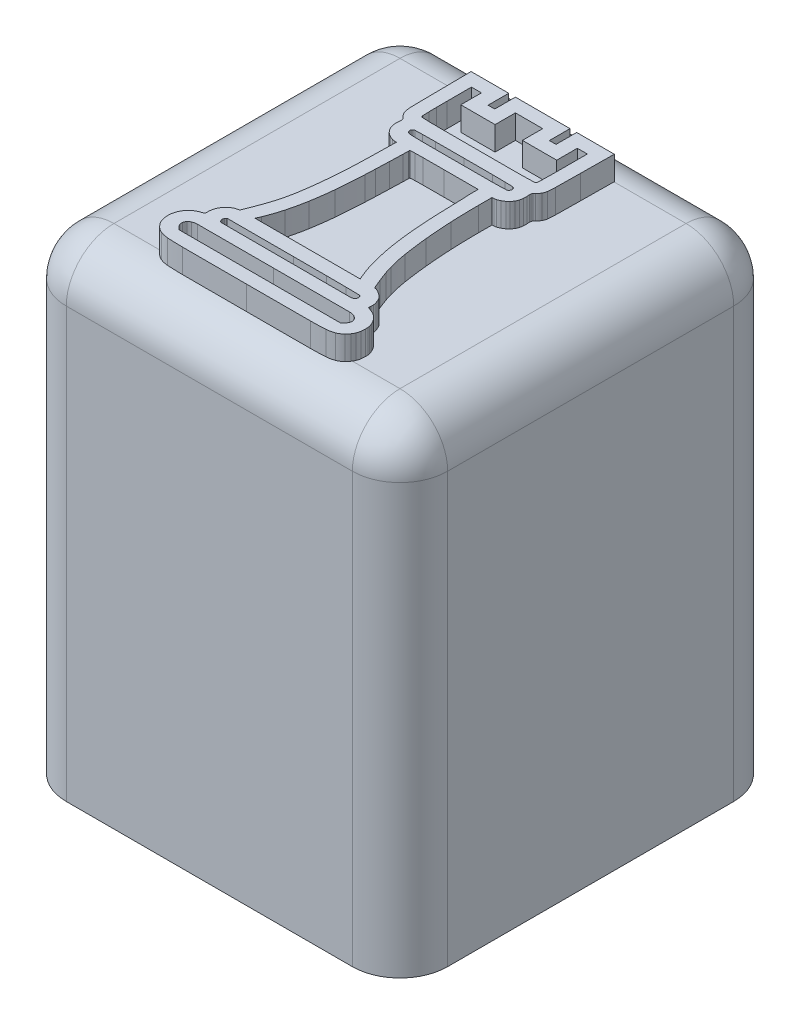
from build123d import *

# Parameters (mm, degrees)
SKETCH1_W           = 40
SKETCH1_H           = 40
BOSS_EXTRUDE1_DEPTH = 50
FILLET2_R           = 5
BOSS_EXTRUDE5_DEPTH = 2.5


with BuildPart() as part:
    # Sketch1 → Boss-Extrude1 (new body)
    with BuildSketch(Plane(origin=(0, 0, 0), x_dir=(1, 0, 0), z_dir=(0, 1, 0))):
        Rectangle(SKETCH1_W, SKETCH1_H)
    extrude(amount=BOSS_EXTRUDE1_DEPTH)

    # Fillet2
    fillet2_edges = [part.edges().sort_by_distance(p)[0] for p in [
        (0, 50, 20),
        (-20, 50, 0),
        (0, 50, -20),
        (20, 50, 0),
        (20, 25, -20),
        (-20, 25, -20),
        (-20, 25, 20),
        (20, 25, 20),
    ]]
    fillet(fillet2_edges, radius=FILLET2_R)

    # Sketch7 → Boss-Extrude5 (add)
    with BuildSketch(Plane(origin=(0, 50, 0), x_dir=(1, 0, 0), z_dir=(0, 1, 0))):
        with BuildLine():
            Line((-5.274613315, 4.694031011), (-5.071502507, 4.693348647))
            Line((-5.071502507, 4.693348647), (-5.115931857, 2.440686147))
            ThreePointArc((-5.115931857, 2.440686147), (-5.135493361, 1.586777154), (-5.160492105, 0.733010041))
            ThreePointArc((-5.160492105, 0.733010041), (-5.186559634, 0.065160432), (-5.221382725, -0.602289917))
            ThreePointArc((-5.221382725, -0.602289917), (-5.262100246, -1.217994079), (-5.31186865, -1.833032808))
            ThreePointArc((-5.31186865, -1.833032808), (-5.375915726, -2.516439369), (-5.447270012, -3.199121668))
            ThreePointArc((-5.447270012, -3.199121668), (-5.544021498, -3.997931443), (-5.658389751, -4.794409823))
            ThreePointArc((-5.658389751, -4.794409823), (-5.774097432, -5.459438073), (-5.914466137, -6.119701254))
            ThreePointArc((-5.914466137, -6.119701254), (-6.070211142, -6.734003471), (-6.25066229, -7.341507465))
            ThreePointArc((-6.25066229, -7.341507465), (-6.4669483, -7.982117191), (-6.704447145, -8.615169129))
            Line((-6.704447145, -8.615169129), (-7.118383624, -9.665011975))
            Line((-7.118383624, -9.665011975), (-7.44877615, -9.762565253))
            ThreePointArc((-7.44877615, -9.762565253), (-7.628823527, -9.830715509), (-7.796714017, -9.924919005))
            ThreePointArc((-7.796714017, -9.924919005), (-7.96786677, -10.052607106), (-8.123996332, -10.19828166))
            ThreePointArc((-8.123996332, -10.19828166), (-8.265734193, -10.362837202), (-8.388878289, -10.541732923))
            ThreePointArc((-8.388878289, -10.541732923), (-8.482889519, -10.72129569), (-8.552271199, -10.911734869))
            ThreePointArc((-8.552271199, -10.911734869), (-8.574954627, -10.995786253), (-8.594375103, -11.080650958))
            ThreePointArc((-8.594375103, -11.080650958), (-8.611882419, -11.171820917), (-8.626475998, -11.263502402))
            ThreePointArc((-8.626475998, -11.263502402), (-8.637187765, -11.348276402), (-8.645142851, -11.433353365))
            ThreePointArc((-8.645142851, -11.433353365), (-8.647401754, -11.495608211), (-8.644586566, -11.557840384))
            ThreePointArc((-8.644586566, -11.557840384), (-8.640027054, -11.635308954), (-8.639679254, -11.712910806))
            ThreePointArc((-8.639679254, -11.712910806), (-8.647075054, -11.752525478), (-8.666690598, -11.787728469))
            ThreePointArc((-8.666690598, -11.787728469), (-8.697849705, -11.817602005), (-8.73589714, -11.837990992))
            ThreePointArc((-8.73589714, -11.837990992), (-8.824213052, -11.869091004), (-8.913544061, -11.897142417))
            ThreePointArc((-8.913544061, -11.897142417), (-9.225813535, -12.016966022), (-9.515244254, -12.184595912))
            ThreePointArc((-9.515244254, -12.184595912), (-9.771838642, -12.39450575), (-9.99101328, -12.643233108))
            ThreePointArc((-9.99101328, -12.643233108), (-10.167275029, -12.92459187), (-10.295688922, -13.230763111))
            ThreePointArc((-10.295688922, -13.230763111), (-10.374607959, -13.557101502), (-10.401466688, -13.891770844))
            ThreePointArc((-10.401466688, -13.891770844), (-10.393160937, -14.124937934), (-10.367596633, -14.35684814))
            ThreePointArc((-10.367596633, -14.35684814), (-10.326822143, -14.551570422), (-10.263206436, -14.740070735))
            ThreePointArc((-10.263206436, -14.740070735), (-10.178410285, -14.917660686), (-10.072811681, -15.083725471))
            ThreePointArc((-10.072811681, -15.083725471), (-9.932582512, -15.262008926), (-9.778675217, -15.428627518))
            ThreePointArc((-9.778675217, -15.428627518), (-9.495185465, -15.657409016), (-9.169774886, -15.821163004))
            ThreePointArc((-9.169774886, -15.821163004), (-8.774531746, -15.937344072), (-8.366484798, -15.994026247))
            ThreePointArc((-8.366484798, -15.994026247), (-7.57729415, -16.032346599), (-6.787292878, -16.046069457))
            ThreePointArc((-6.787292878, -16.046069457), (-3.425822319, -16.050594706), (-0.064349053, -16.052101353))
            ThreePointArc((-0.064349053, -16.052101353), (3.297124214, -16.050594706), (6.658594772, -16.046069457))
            ThreePointArc((6.658594772, -16.046069457), (7.448596045, -16.032346599), (8.237786692, -15.994026247))
            ThreePointArc((8.237786692, -15.994026247), (8.64583364, -15.937344072), (9.04107678, -15.821163004))
            ThreePointArc((9.04107678, -15.821163004), (9.366487359, -15.657409016), (9.649977112, -15.428627518))
            ThreePointArc((9.649977112, -15.428627518), (9.804085436, -15.261775175), (9.94447938, -15.083229326))
            ThreePointArc((9.94447938, -15.083229326), (10.050071007, -14.917026777), (10.134768173, -14.739264945))
            ThreePointArc((10.134768173, -14.739264945), (10.198411696, -14.550054304), (10.23914384, -14.354626421))
            ThreePointArc((10.23914384, -14.354626421), (10.264862639, -14.120672036), (10.273450947, -13.885464996))
            ThreePointArc((10.273450947, -13.885464996), (10.270947173, -13.756388341), (10.263439766, -13.627505872))
            ThreePointArc((10.263439766, -13.627505872), (10.251594995, -13.526724896), (10.231851151, -13.427189553))
            ThreePointArc((10.231851151, -13.427189553), (10.204123074, -13.328552452), (10.168830246, -13.232362327))
            ThreePointArc((10.168830246, -13.232362327), (10.116177863, -13.110788077), (10.059127189, -12.991214701))
            ThreePointArc((10.059127189, -12.991214701), (9.938919874, -12.778042333), (9.798016084, -12.577946408))
            ThreePointArc((9.798016084, -12.577946408), (9.646975622, -12.407709544), (9.475993335, -12.257513445))
            ThreePointArc((9.475993335, -12.257513445), (9.279164164, -12.122778377), (9.067986143, -12.011877049))
            ThreePointArc((9.067986143, -12.011877049), (8.81178561, -11.907252136), (8.548462659, -11.822128057))
            ThreePointArc((8.548462659, -11.822128057), (8.529373641, -11.812444577), (8.515377158, -11.796250169))
            ThreePointArc((8.515377158, -11.796250169), (8.503559264, -11.770551628), (8.496390112, -11.743189594))
            ThreePointArc((8.496390112, -11.743189594), (8.491978174, -11.703792653), (8.492103208, -11.664149639))
            ThreePointArc((8.492103208, -11.664149639), (8.496598204, -11.611759341), (8.50371598, -11.559660535))
            ThreePointArc((8.50371598, -11.559660535), (8.515327315, -11.418385332), (8.504602027, -11.277040101))
            ThreePointArc((8.504602027, -11.277040101), (8.469877186, -11.099484949), (8.421586909, -10.925129864))
            ThreePointArc((8.421586909, -10.925129864), (8.357807239, -10.748613268), (8.280807377, -10.577449672))
            ThreePointArc((8.280807377, -10.577449672), (8.200014785, -10.435861025), (8.103432942, -10.304534197))
            ThreePointArc((8.103432942, -10.304534197), (8.00739313, -10.201008589), (7.900383602, -10.108866535))
            ThreePointArc((7.900383602, -10.108866535), (7.753952226, -10.002582002), (7.601992923, -9.904363268))
            ThreePointArc((7.601992923, -9.904363268), (7.452579423, -9.818478024), (7.299046907, -9.740193695))
            ThreePointArc((7.299046907, -9.740193695), (7.203648634, -9.707001547), (7.103269441, -9.695751353))
            ThreePointArc((7.103269441, -9.695751353), (7.035141561, -9.675167106), (6.989809991, -9.620302107))
            ThreePointArc((6.989809991, -9.620302107), (6.794147044, -9.149794258), (6.601327621, -8.678113968))
            ThreePointArc((6.601327621, -8.678113968), (6.415795526, -8.206873439), (6.239699712, -7.732026033))
            ThreePointArc((6.239699712, -7.732026033), (6.105366415, -7.336600456), (5.985085356, -6.936676353))
            ThreePointArc((5.985085356, -6.936676353), (5.746997048, -5.983856003), (5.565746818, -5.018609393))
            ThreePointArc((5.565746818, -5.018609393), (5.387145974, -3.768080321), (5.24394682, -2.513004536))
            ThreePointArc((5.24394682, -2.513004536), (5.121296012, -1.096537503), (5.035800875, 0.322656867))
            ThreePointArc((5.035800875, 0.322656867), (4.983441307, 1.800362149), (4.965518853, 3.278886147))
            Line((4.965518853, 3.278886147), (4.964850947, 4.693348647))
            Line((4.964850947, 4.693348647), (5.156938447, 4.694031011))
            ThreePointArc((5.156938447, 4.694031011), (5.284693719, 4.705324601), (5.408721643, 4.737974694))
            ThreePointArc((5.408721643, 4.737974694), (5.572045946, 4.802449755), (5.730617754, 4.877860914))
            ThreePointArc((5.730617754, 4.877860914), (5.889526273, 4.967131234), (6.042008635, 5.066982304))
            ThreePointArc((6.042008635, 5.066982304), (6.160206761, 5.161178066), (6.266465254, 5.268661885))
            ThreePointArc((6.266465254, 5.268661885), (6.381636634, 5.41317896), (6.482530094, 5.568001895))
            ThreePointArc((6.482530094, 5.568001895), (6.56197389, 5.723182125), (6.623338194, 5.886358846))
            ThreePointArc((6.623338194, 5.886358846), (6.667211764, 6.059617931), (6.691814384, 6.236644233))
            ThreePointArc((6.691814384, 6.236644233), (6.700170548, 6.433951482), (6.692413208, 6.631283182))
            ThreePointArc((6.692413208, 6.631283182), (6.681807637, 6.78211385), (6.674190601, 6.933124939))
            ThreePointArc((6.674190601, 6.933124939), (6.676901816, 7.00258216), (6.69057783, 7.07073363))
            ThreePointArc((6.69057783, 7.07073363), (6.71373595, 7.128023504), (6.748490954, 7.179116732))
            ThreePointArc((6.748490954, 7.179116732), (6.818549413, 7.257725686), (6.892302325, 7.332879283))
            ThreePointArc((6.892302325, 7.332879283), (7.054166821, 7.515677205), (7.186783429, 7.720684597))
            ThreePointArc((7.186783429, 7.720684597), (7.276036497, 7.928936012), (7.324793617, 8.150199442))
            ThreePointArc((7.324793617, 8.150199442), (7.361267317, 8.529446009), (7.377212829, 8.910108628))
            ThreePointArc((7.377212829, 8.910108628), (7.395008806, 10.21564498), (7.409600947, 11.521221072))
            Line((7.409600947, 11.521221072), (7.444525947, 15.031218497))
            Line((7.444525947, 15.031218497), (5.471263447, 15.031183572))
            Line((5.471263447, 15.031183572), (3.498000947, 15.031148647))
            Line((3.498000947, 15.031148647), (3.498000947, 13.948473647))
            Line((3.498000947, 13.948473647), (3.498000947, 12.865798647))
            Line((3.498000947, 12.865798647), (3.148750947, 12.865798647))
            Line((3.148750947, 12.865798647), (2.799500947, 12.865798647))
            Line((2.799500947, 12.865798647), (2.799500947, 13.948473647))
            Line((2.799500947, 13.948473647), (2.799500947, 15.031148647))
            Line((2.799500947, 15.031148647), (-0.064349053, 15.031148647))
            Line((-0.064349053, 15.031148647), (-2.928199053, 15.031148647))
            Line((-2.928199053, 15.031148647), (-2.928199053, 13.948473647))
            Line((-2.928199053, 13.948473647), (-2.928199053, 12.865798647))
            Line((-2.928199053, 12.865798647), (-3.277449053, 12.865798647))
            Line((-3.277449053, 12.865798647), (-3.626699053, 12.865798647))
            Line((-3.626699053, 12.865798647), (-3.626699053, 13.948473647))
            Line((-3.626699053, 13.948473647), (-3.626699053, 15.031148647))
            Line((-3.626699053, 15.031148647), (-5.599961553, 15.031183572))
            Line((-5.599961553, 15.031183572), (-7.573224053, 15.031218497))
            Line((-7.573224053, 15.031218497), (-7.538299053, 11.521221072))
            ThreePointArc((-7.538299053, 11.521221072), (-7.523706911, 10.21564498), (-7.505910935, 8.910108628))
            ThreePointArc((-7.505910935, 8.910108628), (-7.489965422, 8.529446009), (-7.453491723, 8.150199442))
            ThreePointArc((-7.453491723, 8.150199442), (-7.404734603, 7.928936012), (-7.315481534, 7.720684597))
            ThreePointArc((-7.315481534, 7.720684597), (-7.182864927, 7.515677205), (-7.02100043, 7.332879283))
            ThreePointArc((-7.02100043, 7.332879283), (-6.947247518, 7.257725686), (-6.877189059, 7.179116732))
            ThreePointArc((-6.877189059, 7.179116732), (-6.842434056, 7.128023504), (-6.819275935, 7.07073363))
            ThreePointArc((-6.819275935, 7.07073363), (-6.805599922, 7.00258216), (-6.802888706, 6.933124939))
            ThreePointArc((-6.802888706, 6.933124939), (-6.810505743, 6.78211385), (-6.821111314, 6.631283182))
            ThreePointArc((-6.821111314, 6.631283182), (-6.828868653, 6.433951482), (-6.82051249, 6.236644233))
            ThreePointArc((-6.82051249, 6.236644233), (-6.79590987, 6.059617931), (-6.7520363, 5.886358846))
            ThreePointArc((-6.7520363, 5.886358846), (-6.690671995, 5.723182125), (-6.611228199, 5.568001895))
            ThreePointArc((-6.611228199, 5.568001895), (-6.510334739, 5.41317896), (-6.39516336, 5.268661885))
            ThreePointArc((-6.39516336, 5.268661885), (-6.287832472, 5.160118491), (-6.168422436, 5.065024688))
            ThreePointArc((-6.168422436, 5.065024688), (-6.015546931, 4.965211527), (-5.856090047, 4.876289708))
            ThreePointArc((-5.856090047, 4.876289708), (-5.696623457, 4.801435919), (-5.53231525, 4.737910362))
            ThreePointArc((-5.53231525, 4.737910362), (-5.405281678, 4.705297188), (-5.274613315, 4.694031011))
        make_face()
        with BuildLine():
            Line((-5.093549053, 12.551473647), (-5.093549053, 11.468798647))
            Line((-5.093549053, 11.468798647), (-3.294911553, 11.468741579))
            Line((-3.294911553, 11.468741579), (-1.496274053, 11.468684512))
            Line((-1.496274053, 11.468684512), (-1.496274053, 12.533954079))
            Line((-1.496274053, 12.533954079), (-1.496274053, 13.599223647))
            Line((-1.496274053, 13.599223647), (-0.064349053, 13.599223647))
            Line((-0.064349053, 13.599223647), (1.367575947, 13.599223647))
            Line((1.367575947, 13.599223647), (1.367575947, 12.5339538))
            Line((1.367575947, 12.5339538), (1.367575947, 11.468683883))
            Line((1.367575947, 11.468683883), (3.166213447, 11.4687413))
            Line((3.166213447, 11.4687413), (4.964850947, 11.468798647))
            Line((4.964850947, 11.468798647), (4.964850947, 12.551473647))
            Line((4.964850947, 12.551473647), (4.964850947, 13.634148647))
            Line((4.964850947, 13.634148647), (5.488725947, 13.634148647))
            Line((5.488725947, 13.634148647), (6.012600947, 13.634148647))
            Line((6.012600947, 13.634148647), (6.012600947, 11.080031638))
            ThreePointArc((6.012600947, 11.080031638), (6.01148728, 10.530998263), (6.008146752, 9.981973922))
            ThreePointArc((6.008146752, 9.981973922), (6.002867641, 9.569730256), (5.993720352, 9.157554279))
            ThreePointArc((5.993720352, 9.157554279), (5.984313066, 8.835473662), (5.973412722, 8.513440117))
            ThreePointArc((5.973412722, 8.513440117), (5.963861843, 8.450230522), (5.940293345, 8.390806638))
            ThreePointArc((5.940293345, 8.390806638), (5.88171471, 8.327629623), (5.79968271, 8.301294422))
            ThreePointArc((5.79968271, 8.301294422), (5.442003442, 8.284680412), (5.084104735, 8.273771706))
            ThreePointArc((5.084104735, 8.273771706), (4.432606634, 8.262561831), (3.781026372, 8.25824915))
            ThreePointArc((3.781026372, 8.25824915), (1.858339083, 8.256335566), (-0.064349053, 8.255698647))
            ThreePointArc((-0.064349053, 8.255698647), (-1.987037188, 8.256335566), (-3.909724477, 8.25824915))
            ThreePointArc((-3.909724477, 8.25824915), (-4.561304739, 8.262561831), (-5.21280284, 8.273771706))
            ThreePointArc((-5.21280284, 8.273771706), (-5.570701547, 8.284680412), (-5.928380816, 8.301294422))
            ThreePointArc((-5.928380816, 8.301294422), (-6.010412815, 8.327629623), (-6.06899145, 8.390806638))
            ThreePointArc((-6.06899145, 8.390806638), (-6.092559949, 8.450230522), (-6.102110828, 8.513440117))
            ThreePointArc((-6.102110828, 8.513440117), (-6.113011171, 8.835473662), (-6.122418458, 9.157554279))
            ThreePointArc((-6.122418458, 9.157554279), (-6.131565747, 9.569730256), (-6.136844858, 9.981973922))
            ThreePointArc((-6.136844858, 9.981973922), (-6.140185386, 10.530998263), (-6.141299053, 11.080031638))
            Line((-6.141299053, 11.080031638), (-6.141299053, 13.634148647))
            Line((-6.141299053, 13.634148647), (-5.617424053, 13.634148647))
            Line((-5.617424053, 13.634148647), (-5.093549053, 13.634148647))
            Line((-5.093549053, 13.634148647), (-5.093549053, 12.551473647))
        make_face(mode=Mode.SUBTRACT)
        with BuildLine():
            Line((5.311218447, -9.304851824), (5.448836358, -9.625901353))
            Line((5.448836358, -9.625901353), (-0.0628697, -9.625901353))
            Line((-0.0628697, -9.625901353), (-5.574575828, -9.625901353))
            Line((-5.574575828, -9.625901353), (-5.370805426, -9.131752977))
            ThreePointArc((-5.370805426, -9.131752977), (-5.035681898, -8.239677913), (-4.757872235, -7.328125672))
            ThreePointArc((-4.757872235, -7.328125672), (-4.505387227, -6.300156381), (-4.300875048, -5.261578357))
            ThreePointArc((-4.300875048, -5.261578357), (-4.115158549, -4.045942489), (-3.977270615, -2.823957178))
            ThreePointArc((-3.977270615, -2.823957178), (-3.857496972, -1.354069539), (-3.771384247, 0.118173647))
            ThreePointArc((-3.771384247, 0.118173647), (-3.748154646, 0.64081029), (-3.727606458, 1.163559224))
            ThreePointArc((-3.727606458, 1.163559224), (-3.702534665, 1.866669878), (-3.678980241, 2.569832999))
            ThreePointArc((-3.678980241, 2.569832999), (-3.657485177, 3.250874182), (-3.637156087, 3.931951166))
            ThreePointArc((-3.637156087, 3.931951166), (-3.6299927, 4.251497885), (-3.627029234, 4.571111147))
            ThreePointArc((-3.627029234, 4.571111147), (-3.60654598, 4.623378762), (-3.556136932, 4.648084939))
            ThreePointArc((-3.556136932, 4.648084939), (-3.328406081, 4.664569002), (-3.100331036, 4.675285297))
            ThreePointArc((-3.100331036, 4.675285297), (-2.685022898, 4.686231704), (-2.269593252, 4.690577069))
            ThreePointArc((-2.269593252, 4.690577069), (-1.166972023, 4.692655304), (-0.064349053, 4.693348647))
            Line((-0.064349053, 4.693348647), (3.498000947, 4.693348647))
            Line((3.498000947, 4.693348647), (3.503191501, 4.047236147))
            ThreePointArc((3.503191501, 4.047236147), (3.50461395, 3.918414203), (3.506811617, 3.789603153))
            ThreePointArc((3.506811617, 3.789603153), (3.509664845, 3.669730443), (3.513412232, 3.549882353))
            ThreePointArc((3.513412232, 3.549882353), (3.517240766, 3.449311397), (3.521684917, 3.348765763))
            ThreePointArc((3.521684917, 3.348765763), (3.524976841, 3.304969456), (3.530696615, 3.261423647))
            ThreePointArc((3.530696615, 3.261423647), (3.537323619, 3.210006224), (3.540833386, 3.158282438))
            ThreePointArc((3.540833386, 3.158282438), (3.550216474, 2.904046976), (3.559270573, 2.649799584))
            ThreePointArc((3.559270573, 2.649799584), (3.569228587, 2.35229075), (3.578300577, 2.054753581))
            ThreePointArc((3.578300577, 2.054753581), (3.58780848, 1.715122817), (3.596634386, 1.375473647))
            ThreePointArc((3.596634386, 1.375473647), (3.66056057, -0.319669046), (3.767576754, -2.012637694))
            ThreePointArc((3.767576754, -2.012637694), (3.906273927, -3.442778117), (4.104421674, -4.86590004))
            ThreePointArc((4.104421674, -4.86590004), (4.329425819, -6.076901902), (4.613540163, -7.275414068))
            ThreePointArc((4.613540163, -7.275414068), (4.924900663, -8.30301732), (5.311218447, -9.304851824))
        make_face(mode=Mode.SUBTRACT)
        with BuildLine():
            Line((-7.144893864, -11.240470273), (-7.041427504, -11.092751353))
            Line((-7.041427504, -11.092751353), (-0.074358278, -11.092751353))
            ThreePointArc((-0.074358278, -11.092751353), (1.664349157, -11.093678868), (3.403054611, -11.096463322))
            ThreePointArc((3.403054611, -11.096463322), (4.413642511, -11.10108489), (5.424195863, -11.110634001))
            ThreePointArc((5.424195863, -11.110634001), (6.145080941, -11.119713418), (6.86595246, -11.129812157))
            ThreePointArc((6.86595246, -11.129812157), (6.925802853, -11.142405321), (6.976530947, -11.176571353))
            ThreePointArc((6.976530947, -11.176571353), (7.019623184, -11.233348183), (7.045853999, -11.299624073))
            ThreePointArc((7.045853999, -11.299624073), (7.059002671, -11.38271371), (7.058116027, -11.466832609))
            ThreePointArc((7.058116027, -11.466832609), (7.043424655, -11.547369715), (7.01514249, -11.624195369))
            ThreePointArc((7.01514249, -11.624195369), (6.977844129, -11.678829397), (6.925242956, -11.718943751))
            ThreePointArc((6.925242956, -11.718943751), (6.764446461, -11.781022842), (6.593374919, -11.802090676))
            ThreePointArc((6.593374919, -11.802090676), (3.229688423, -11.800134171), (-0.133997256, -11.797081104))
            ThreePointArc((-0.133997256, -11.797081104), (-3.530896846, -11.793117317), (-6.927795594, -11.788487738))
            ThreePointArc((-6.927795594, -11.788487738), (-7.023595134, -11.766141922), (-7.099803175, -11.703938853))
            ThreePointArc((-7.099803175, -11.703938853), (-7.141767494, -11.643557786), (-7.177342053, -11.579204635))
            ThreePointArc((-7.177342053, -11.579204635), (-7.199063923, -11.522291564), (-7.21034073, -11.46242696))
            ThreePointArc((-7.21034073, -11.46242696), (-7.210198107, -11.405911956), (-7.198884981, -11.350540671))
            ThreePointArc((-7.198884981, -11.350540671), (-7.176162741, -11.293409348), (-7.144893864, -11.240470273))
        make_face(mode=Mode.SUBTRACT)
        with BuildLine():
            Line((8.638960947, -14.417611353), (8.401470947, -14.655101353))
            Line((8.401470947, -14.655101353), (-0.064349053, -14.655101353))
            Line((-0.064349053, -14.655101353), (-8.530169053, -14.655101353))
            Line((-8.530169053, -14.655101353), (-8.767659053, -14.417611353))
            ThreePointArc((-8.767659053, -14.417611353), (-8.88247838, -14.276208898), (-8.965823643, -14.114246866))
            ThreePointArc((-8.965823643, -14.114246866), (-9.003952656, -13.953827062), (-8.99674973, -13.789095605))
            ThreePointArc((-8.99674973, -13.789095605), (-8.944838395, -13.633275087), (-8.852059506, -13.497750557))
            ThreePointArc((-8.852059506, -13.497750557), (-8.716878514, -13.377752757), (-8.559624658, -13.288620285))
            ThreePointArc((-8.559624658, -13.288620285), (-8.315729116, -13.210996607), (-8.061145791, -13.184580666))
            ThreePointArc((-8.061145791, -13.184580666), (-4.069109832, -13.181344122), (-0.077072859, -13.179800202))
            ThreePointArc((-0.077072859, -13.179800202), (3.910991397, -13.179975264), (7.899055194, -13.181897099))
            ThreePointArc((7.899055194, -13.181897099), (8.16243831, -13.20818271), (8.415540553, -13.285647888))
            ThreePointArc((8.415540553, -13.285647888), (8.577072406, -13.373780918), (8.716997926, -13.4932833))
            ThreePointArc((8.716997926, -13.4932833), (8.81306321, -13.628152583), (8.867693224, -13.784465807))
            ThreePointArc((8.867693224, -13.784465807), (8.876548716, -13.949805925), (8.838927667, -14.111052416))
            ThreePointArc((8.838927667, -14.111052416), (8.754897481, -14.274738053), (8.638960947, -14.417611353))
        make_face(mode=Mode.SUBTRACT)
        with BuildLine():
            ThreePointArc((5.282717691, 6.570156469), (5.247939067, 6.627795068), (5.204336632, 6.679084331))
            ThreePointArc((5.204336632, 6.679084331), (5.133298271, 6.727566322), (5.049476108, 6.746822416))
            ThreePointArc((5.049476108, 6.746822416), (4.65335071, 6.760559933), (4.25711545, 6.770643082))
            ThreePointArc((4.25711545, 6.770643082), (3.599112829, 6.781266077), (2.941039539, 6.785720624))
            ThreePointArc((2.941039539, 6.785720624), (1.438346056, 6.788066036), (-0.064349053, 6.788848647))
            ThreePointArc((-0.064349053, 6.788848647), (-1.567044162, 6.788066036), (-3.069737645, 6.785720624))
            ThreePointArc((-3.069737645, 6.785720624), (-3.727810934, 6.781266077), (-4.385813556, 6.770643082))
            ThreePointArc((-4.385813556, 6.770643082), (-4.782048815, 6.760559933), (-5.178174214, 6.746822416))
            ThreePointArc((-5.178174214, 6.746822416), (-5.261996377, 6.727566322), (-5.333034737, 6.679084331))
            ThreePointArc((-5.333034737, 6.679084331), (-5.377977158, 6.625421614), (-5.412804275, 6.564704397))
            ThreePointArc((-5.412804275, 6.564704397), (-5.432473619, 6.504328012), (-5.437526984, 6.441029873))
            ThreePointArc((-5.437526984, 6.441029873), (-5.427696729, 6.377590471), (-5.403571642, 6.318099531))
            ThreePointArc((-5.403571642, 6.318099531), (-5.36401268, 6.258318315), (-5.315061494, 6.205949558))
            ThreePointArc((-5.315061494, 6.205949558), (-5.234057167, 6.154800964), (-5.140533725, 6.134034513))
            ThreePointArc((-5.140533725, 6.134034513), (-4.767880349, 6.11908306), (-4.39507343, 6.10863866))
            ThreePointArc((-4.39507343, 6.10863866), (-3.757355924, 6.097819285), (-3.119562138, 6.093373641))
            ThreePointArc((-3.119562138, 6.093373641), (-1.585888018, 6.091105042), (-0.052212406, 6.090348647))
            ThreePointArc((-0.052212406, 6.090348647), (1.559829899, 6.091040076), (3.171871018, 6.093114637))
            ThreePointArc((3.171871018, 6.093114637), (3.768071612, 6.09750717), (4.364184464, 6.10863866))
            ThreePointArc((4.364184464, 6.10863866), (4.696404074, 6.119638886), (5.028379452, 6.136468087))
            ThreePointArc((5.028379452, 6.136468087), (5.121455459, 6.160569604), (5.198500035, 6.218086206))
            ThreePointArc((5.198500035, 6.218086206), (5.243429435, 6.275083752), (5.280214058, 6.337647822))
            ThreePointArc((5.280214058, 6.337647822), (5.301225657, 6.395069037), (5.308871208, 6.455733927))
            ThreePointArc((5.308871208, 6.455733927), (5.302616608, 6.514504536), (5.282717691, 6.570156469))
        make_face(mode=Mode.SUBTRACT)
    extrude(amount=BOSS_EXTRUDE5_DEPTH)


solid = part.part
